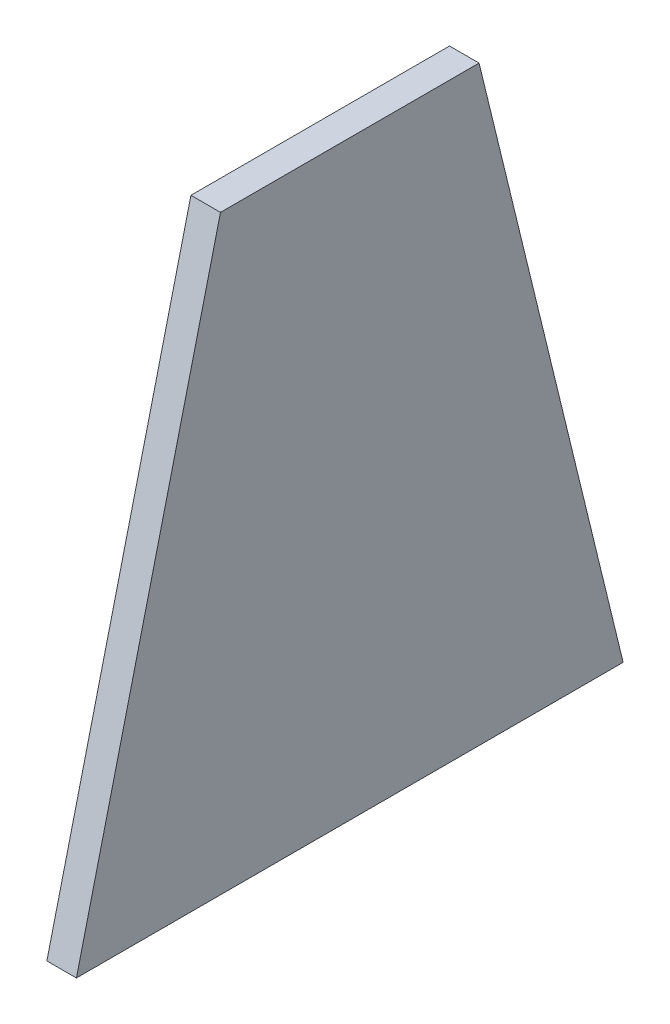
from build123d import *

# Parameters (mm, degrees)
BOSS_EXTRUDE1_DEPTH = 4


with BuildPart() as part:
    # Sketch2 → Boss-Extrude1 (new body)
    with BuildSketch(Plane(origin=(0, 0, 0), x_dir=(0, 0, -1), z_dir=(1, 0, 0))):
        Polygon((17.5, 80), (-17.5, 80), (-37, 0), (37, 0), align=None)
    extrude(amount=BOSS_EXTRUDE1_DEPTH)


solid = part.part
